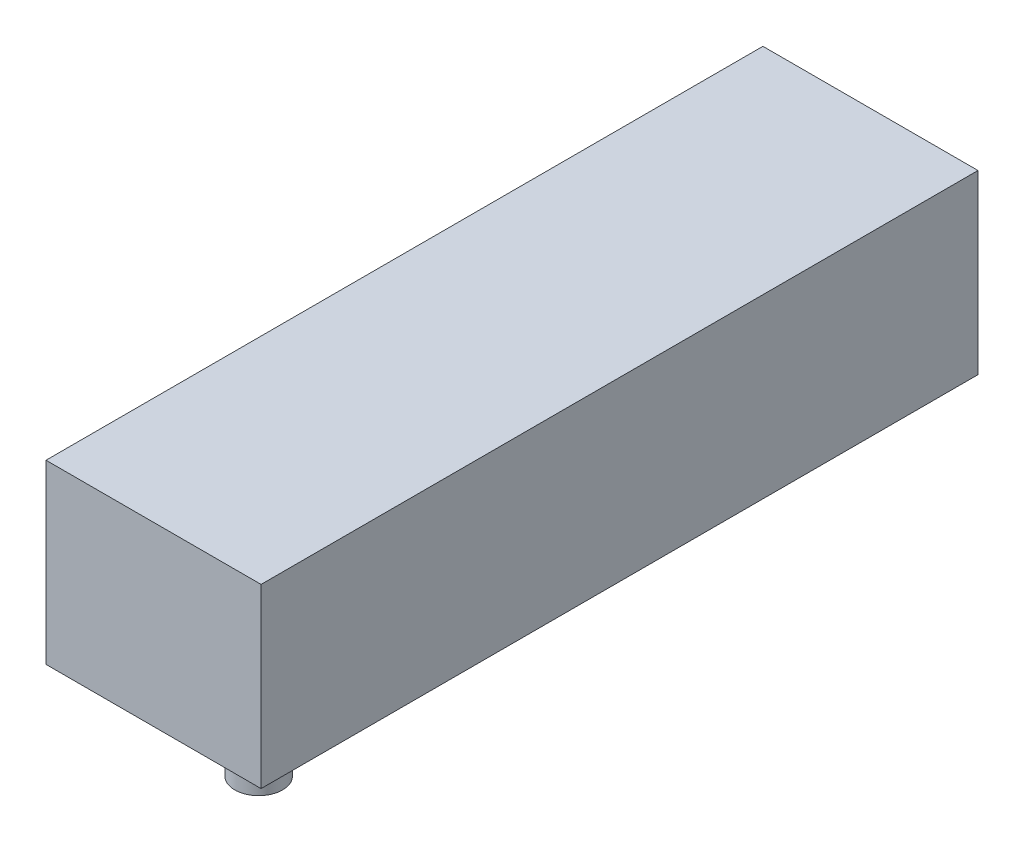
from build123d import *

# Parameters (mm, degrees)
SKETCH1_W           = 22.5
SKETCH1_H           = 75
BOSS_EXTRUDE1_DEPTH = 18.5
SKETCH2_R           = 2.5
BOSS_EXTRUDE2_DEPTH = 10


with BuildPart() as part:
    # Sketch1 → Boss-Extrude1 (new body)
    with BuildSketch(Plane(origin=(0, 0, 0), x_dir=(1, 0, 0), z_dir=(0, 1, 0))):
        with Locations((1.654599237, -26.805736676)):
            Rectangle(SKETCH1_W, SKETCH1_H)
    extrude(amount=BOSS_EXTRUDE1_DEPTH)

    # Sketch2 → Boss-Extrude2 (add)
    with BuildSketch(Plane(origin=(0, 0, 0), x_dir=(-1, 0, 0), z_dir=(0, -1, 0))):
        with Locations(Location((-1.654599237, -53.305736676, 0), (0, 0, 90))):
            Circle(SKETCH2_R)
    extrude(amount=BOSS_EXTRUDE2_DEPTH)


solid = part.part
